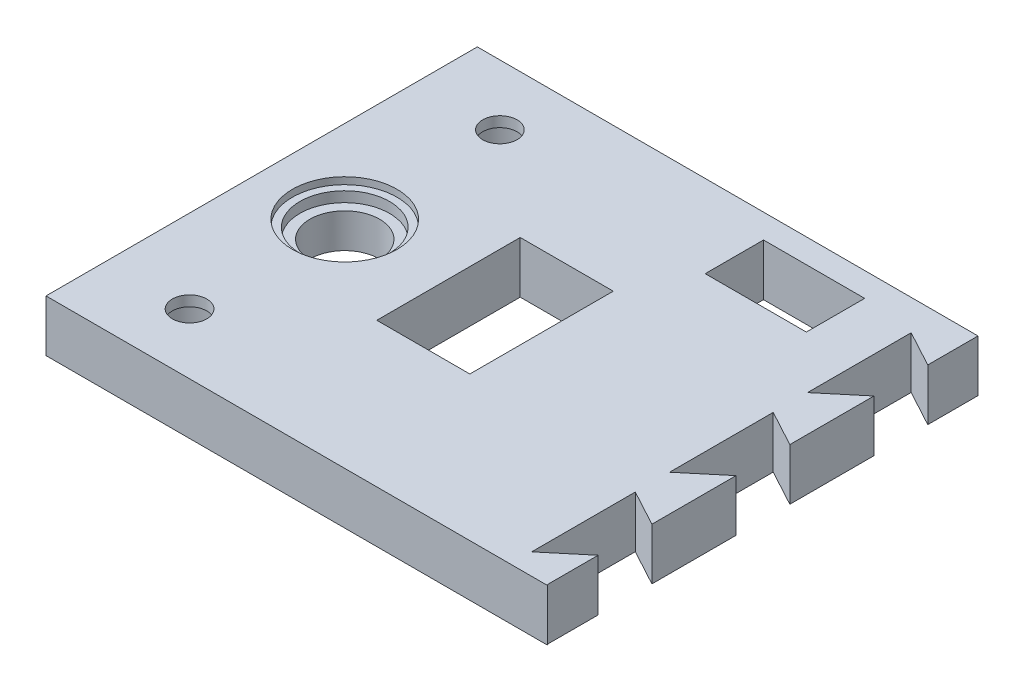
from build123d import *

# Parameters (mm, degrees)
SKETCH1_W           = 280
SKETCH1_H           = 210
BOSS_EXTRUDE1_DEPTH = 15
SKETCH2_R           = 5
BOSS_EXTRUDE2_DEPTH = 50
SKETCH3_W           = 10
SKETCH3_H           = 30
BOSS_EXTRUDE3_DEPTH = 50
SKETCH4_R           = 13
CUT_EXTRUDE1_DEPTH  = 20
SKETCH5_W           = 360.4909063
SKETCH5_H           = 249.182613404
SKETCH5_W_2         = 248.173776912
SKETCH5_H_2         = 125.095724948
CUT_EXTRUDE5_DEPTH  = 15
CUT_EXTRUDE6_START  = -65
SKETCH7_R           = 5
CUT_EXTRUDE6_DEPTH  = 65
SKETCH8_R           = 10.1
CUT_EXTRUDE11_DEPTH = 12
SKETCH13_W          = 26.98462743
SKETCH13_H          = 41.59552633
CUT_EXTRUDE12_DEPTH = 148.681383345
SKETCH11_W          = 17.231524428
SKETCH11_H          = 37.334969593
CUT_EXTRUDE13_DEPTH = 50
CUT_EXTRUDE16_DEPTH = 140.766916639
SKETCH16_R          = 13
CUT_EXTRUDE20_DEPTH = 5
CUT_EXTRUDE22_DEPTH = 2
SKETCH18_R          = 15.15
CUT_EXTRUDE23_DEPTH = 2
SKETCH9_W           = 29.33
SKETCH9_H           = 16.92
CUT_EXTRUDE24_DEPTH = 140.766916639


with BuildPart() as part:
    # Sketch1 → Boss-Extrude1 (new body)
    with BuildSketch(Plane(origin=(0, 0, 0), x_dir=(1, 0, 0), z_dir=(0, 1, 0))):
        Rectangle(SKETCH1_W, SKETCH1_H)
    extrude(amount=BOSS_EXTRUDE1_DEPTH)

    # Sketch2 → Boss-Extrude2 (add)
    with BuildSketch(Plane(origin=(0, 15, 0), x_dir=(1, 0, 0), z_dir=(0, 1, 0))):
        with Locations(Location((-100, 0, 0), (0, 0, 270))):
            Circle(SKETCH2_R)
        with Locations(Location((-100, 45, 0), (0, 0, 270))):
            Circle(SKETCH2_R)
        with Locations(Location((-100, -45, 0), (0, 0, 270))):
            Circle(SKETCH2_R)
    extrude(amount=BOSS_EXTRUDE2_DEPTH)

    # Sketch3 → Boss-Extrude3 (add)
    with BuildSketch(Plane(origin=(0, 15, 0), x_dir=(1, 0, 0), z_dir=(0, 1, 0))):
        Rectangle(SKETCH3_W, SKETCH3_H)
    extrude(amount=BOSS_EXTRUDE3_DEPTH)

    # Sketch4 → Cut-Extrude1 (cut)
    with BuildSketch(Plane(origin=(5, 0, 0), x_dir=(0, 0, -1), z_dir=(1, 0, 0))):
        with Locations((0, 41.236240869)):
            Circle(SKETCH4_R)
    extrude(amount=-CUT_EXTRUDE1_DEPTH, mode=Mode.SUBTRACT)

    # Sketch5 → Cut-Extrude5 (cut)
    with BuildSketch(Plane(origin=(0, 0, 0), x_dir=(1, 0, 0), z_dir=(0, 1, 0))):
        with Locations((1.345115322, -3.19464889)):
            Rectangle(SKETCH5_W, SKETCH5_H)
        Rectangle(SKETCH5_W_2, SKETCH5_H_2, mode=Mode.SUBTRACT)
    extrude(amount=CUT_EXTRUDE5_DEPTH, mode=Mode.SUBTRACT)

    # Sketch7 → Cut-Extrude6 (cut)
    with BuildSketch(Plane(origin=(0, 65, 0), x_dir=(1, 0, 0), z_dir=(0, 1, 0)).offset(CUT_EXTRUDE6_START)):
        with Locations(Location((-100, 45, 0), (0, 0, 270))):
            Circle(SKETCH7_R)
        with Locations(Location((-100, 0, 0), (0, 0, 270))):
            Circle(SKETCH7_R)
        with Locations(Location((-100, -45, 0), (0, 0, 270))):
            Circle(SKETCH7_R)
    extrude(amount=CUT_EXTRUDE6_DEPTH, mode=Mode.SUBTRACT)

    # Sketch8 → Cut-Extrude11 (cut)
    with BuildSketch(Plane.XZ):
        with Locations(Location((-100, 45, 0), (0, 0, 270))):
            Circle(SKETCH8_R)
        with Locations(Location((-100, 0, 0), (0, 0, 270))):
            Circle(SKETCH8_R)
        with Locations(Location((-100, -45, 0), (0, 0, 270))):
            Circle(SKETCH8_R)
    extrude(amount=-CUT_EXTRUDE11_DEPTH, mode=Mode.SUBTRACT)

    # Sketch13 → Cut-Extrude12 (cut, through all)
    with BuildSketch(Plane(origin=(0, 15, 0), x_dir=(1, 0, 0), z_dir=(0, 1, 0))):
        with Locations((-56.507686285, 0.099999998)):
            Rectangle(SKETCH13_W, SKETCH13_H)
    extrude(amount=-CUT_EXTRUDE12_DEPTH, mode=Mode.SUBTRACT)

    # Sketch11 → Cut-Extrude13 (cut)
    with BuildSketch(Plane(origin=(0, 65, 0), x_dir=(1, 0, 0), z_dir=(0, 1, 0))):
        with Locations((-3.002833284, 0.13632265)):
            Rectangle(SKETCH11_W, SKETCH11_H)
    extrude(amount=-CUT_EXTRUDE13_DEPTH, mode=Mode.SUBTRACT)

    # Sketch10 → Cut-Extrude16 (cut, through all)
    with BuildSketch(Plane(origin=(0, 15, 0), x_dir=(1, 0, 0), z_dir=(0, 1, 0))):
        Polygon((10.617962241, 13.651558309), (10.617962241, -16.40773575), (21.11227659, -7.629229077), (21.11227659, -32.023722987), (10.617962241, -26.348441691), (10.617962241, -56.40773575), (21.11227659, -47.629229077), (21.11227659, -62.347862477), (41.181983769, -80.61345612), (118.859305744, -85.146591928), (147.57727439, -51.586107965), (147.57727439, 65.118065893), (115.028872781, 75.532398006), (21.11227659, 80.76325418), (21.11227659, 62.347862473), (21.11227659, 47.976277013), (10.617962241, 53.651558309), (10.617962241, 23.59226425), (21.11227659, 32.370770923), (21.11227659, 7.976277013), align=None)
    extrude(amount=-CUT_EXTRUDE16_DEPTH, mode=Mode.SUBTRACT)

    # Sketch16 → Cut-Extrude20 (cut)
    with BuildSketch(Plane(origin=(0, 15, 0), x_dir=(1, 0, 0), z_dir=(0, 1, 0))):
        with Locations(Location((-100, 0, 0), (0, 0, 270))):
            Circle(SKETCH16_R)
    extrude(amount=-CUT_EXTRUDE20_DEPTH, mode=Mode.SUBTRACT)

    # Sketch17 → Cut-Extrude22 (cut)
    with BuildSketch(Plane.XZ):
        Polygon((-99.150124323, 10.064179616), (-99.150124323, 12.064179616), (-100.650124323, 12.064179616), (-100.650124323, 10.064179616), (-100.726397945, 9.213176312), (-99.150124323, 9.422776077), align=None)
    extrude(amount=-CUT_EXTRUDE22_DEPTH, mode=Mode.SUBTRACT)

    # Sketch18 → Cut-Extrude23 (cut)
    with BuildSketch(Plane(origin=(0, 15, 0), x_dir=(1, 0, 0), z_dir=(0, 1, 0))):
        with Locations(Location((-100, 0, 0), (0, 0, 270))):
            Circle(SKETCH18_R)
    extrude(amount=-CUT_EXTRUDE23_DEPTH, mode=Mode.SUBTRACT)

    # Sketch9 → Cut-Extrude24 (cut, through all)
    with BuildSketch(Plane(origin=(0, 15, 0), x_dir=(1, 0, 0), z_dir=(0, 1, 0))):
        with Locations((-19.421888456, 47.087862474)):
            Rectangle(SKETCH9_W, SKETCH9_H)
    extrude(amount=-CUT_EXTRUDE24_DEPTH, mode=Mode.SUBTRACT)


solid = part.part
